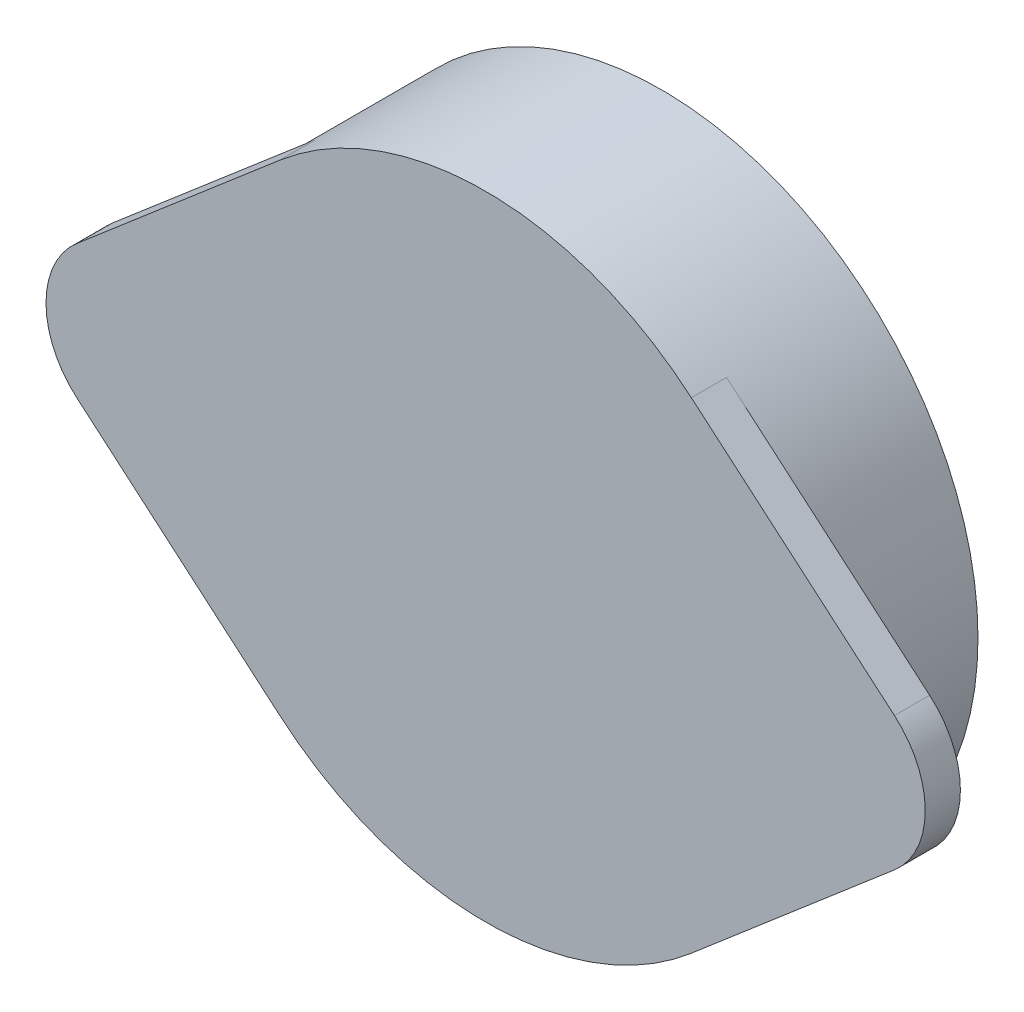
from build123d import *

# Parameters (mm, degrees)
BOSS_EXTRUDE1_DEPTH   = 2
BOSS_EXTRUDE1_2_DEPTH = 2
SKETCH1_3_R           = 18
SKETCH1_3_R_2         = 16
BOSS_EXTRUDE2_DEPTH   = 10
SKETCH1_4_R           = 16
BOSS_EXTRUDE3_DEPTH   = 2


with BuildPart() as part:
    # Sketch1 → Boss-Extrude1 (new body)
    with BuildSketch(Plane(origin=(0, 0, 0), x_dir=(0, 1, 0), z_dir=(0, 0, 1))):
        with BuildLine():
            ThreePointArc((3.799671038, 23.25), (0, 25), (-3.799671038, 23.25))
            Line((-3.799671038, 23.25), (-13.678815738, 11.7))
            ThreePointArc((-13.678815738, 11.7), (0, 18), (13.678815738, 11.7))
            Line((13.678815738, 11.7), (3.799671038, 23.25))
        make_face()
    extrude(amount=-BOSS_EXTRUDE1_DEPTH)



with BuildPart() as body_2:
    # Sketch1 → Boss-Extrude1 2 (new body)
    with BuildSketch(Plane(origin=(0, 0, 0), x_dir=(0, 1, 0), z_dir=(0, 0, 1))):
        with BuildLine():
            ThreePointArc((13.678815738, -11.7), (0, -18), (-13.678815738, -11.7))
            Line((-13.678815738, -11.7), (-3.799671038, -23.25))
            ThreePointArc((-3.799671038, -23.25), (0, -25), (3.799671038, -23.25))
            Line((3.799671038, -23.25), (13.678815738, -11.7))
        make_face()
    extrude(amount=-BOSS_EXTRUDE1_2_DEPTH)


with BuildPart() as part_1:
    add(part.part)

    add(body_2.part)  # Boss-Extrude2 merges body 2
    # Sketch1<3> → Boss-Extrude2 (add)
    with BuildSketch(Plane(origin=(0, 0, 0), x_dir=(0, 1, 0), z_dir=(0, 0, 1))):
        Circle(SKETCH1_3_R)
        Circle(SKETCH1_3_R_2, mode=Mode.SUBTRACT)
    extrude(amount=-BOSS_EXTRUDE2_DEPTH)

    # Sketch1<4> → Boss-Extrude3 (add)
    with BuildSketch(Plane(origin=(0, 0, 0), x_dir=(0, 1, 0), z_dir=(0, 0, 1))):
        Circle(SKETCH1_4_R)
    extrude(amount=-BOSS_EXTRUDE3_DEPTH)


solid = part_1.part
